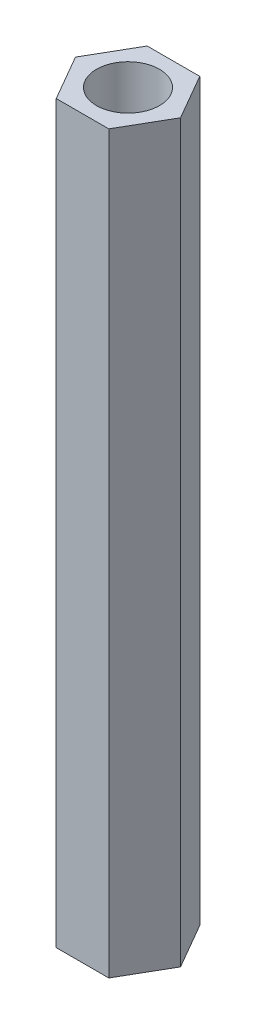
from build123d import *

# Parameters (mm, degrees)
RESSALTO_EXTRUS_O1_DEPTH = 35
ESBO_O2_R                = 1.5
CORTE_EXTRUS_O1_DEPTH    = 8
CORTE_EXTRUS_O2_START    = -8
ESBO_O3_R                = 1.5
CORTE_EXTRUS_O2_DEPTH    = 8


with BuildPart() as part:
    # Esboço1 → Ressalto-extrusão1 (new body)
    with BuildSketch(Plane(origin=(0, 0, 0), x_dir=(1, 0, 0), z_dir=(0, 1, 0))):
        Polygon((2.5, 0), (1.25, 2.165063509), (-1.25, 2.165063509), (-2.5, 0), (-1.25, -2.165063509), (1.25, -2.165063509), align=None)
    extrude(amount=RESSALTO_EXTRUS_O1_DEPTH)

    # Esboço2 → Corte-extrusão1 (cut)
    with BuildSketch(Plane(origin=(0, 35, 0), x_dir=(1, 0, 0), z_dir=(0, 1, 0))):
        with Locations(Location((0, 0, 0), (0, 0, 270))):
            Circle(ESBO_O2_R)
    extrude(amount=-CORTE_EXTRUS_O1_DEPTH, mode=Mode.SUBTRACT)

    # Esboço3 → Corte-extrusão2 (cut)
    with BuildSketch(Plane.XZ.offset(CORTE_EXTRUS_O2_START)):
        with Locations(Location((0, 0, 0), (0, 0, 90))):
            Circle(ESBO_O3_R)
    extrude(amount=CORTE_EXTRUS_O2_DEPTH, mode=Mode.SUBTRACT)


solid = part.part
